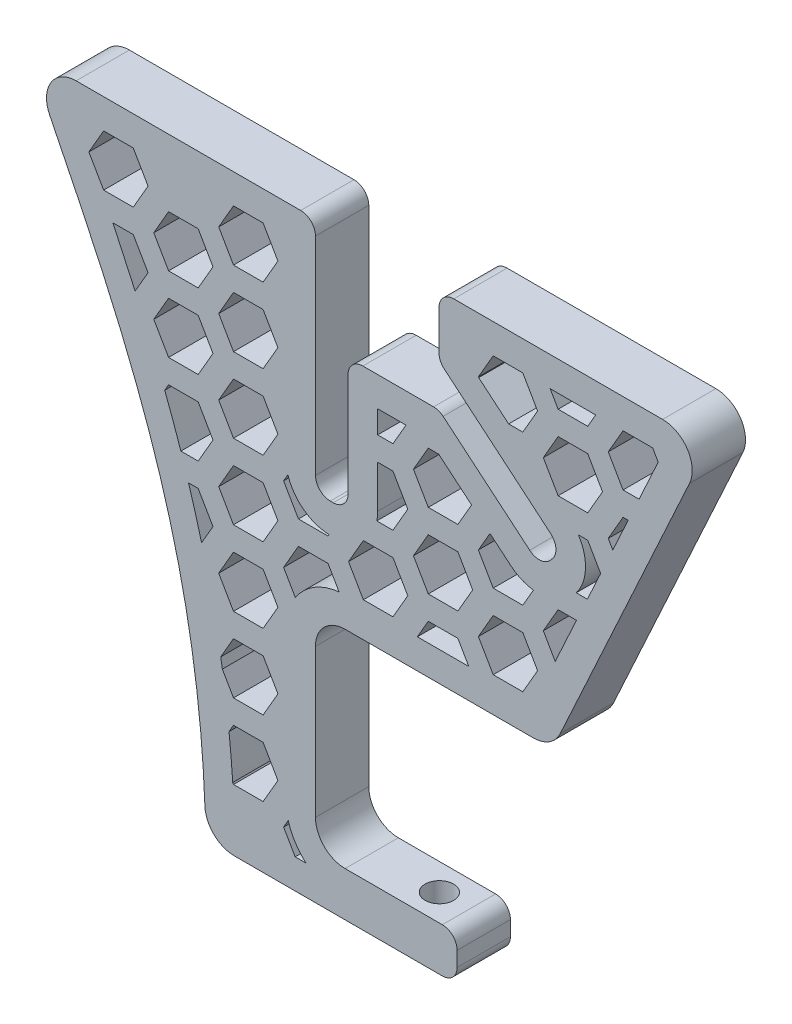
from build123d import *

# Parameters (mm, degrees)
BOSS_EXTRUDE1_DEPTH = 18
SKETCH2_R           = 4.8
CUT_EXTRUDE1_DEPTH  = 226.252230702
CUT_EXTRUDE4_DEPTH  = 173.448738534


with BuildPart() as part:
    # Sketch1 → Boss-Extrude1 (new body)
    with BuildSketch(Plane.XY):
        with BuildLine():
            Line((0, -10), (0, -60))
            ThreePointArc((0, -60), (2.928932188, -67.071067812), (10, -70))
            Line((10, -70), (42.837837838, -70))
            ThreePointArc((42.837837838, -70), (46.373371744, -71.464466094), (47.837837838, -75))
            Line((47.837837838, -75), (47.837837838, -80))
            ThreePointArc((47.837837838, -80), (46.373371744, -83.535533906), (42.837837838, -85))
            Line((42.837837838, -85), (-27.357771552, -85))
            ThreePointArc((-27.357771552, -85), (-34.290560198, -82.20669422), (-37.350269125, -75.387288317))
            add(Edge.make_bspline(
                [(-89.801053361, 100.550093593), (-65.054959436, 50.749049183), (-40.308865512, 0.948004772), (-37.350269125, -75.387288317)],
                knots=[0, 0, 0, 0, 1, 1, 1, 1], degree=3))
            ThreePointArc((-89.801053361, 100.550093593), (-89.345673636, 110.267871294), (-80.845701164, 115))
            Line((-80.845701164, 115), (-37.162162162, 115))
            Line((-37.162162162, 115), (-5, 115))
            ThreePointArc((-5, 115), (-1.464466094, 113.535533906), (0, 110))
            Line((0, 110), (0, 40))
            ThreePointArc((0, 40), (1.464466094, 36.464466094), (5, 35))
            Line((5, 35), (6, 35))
            ThreePointArc((6, 35), (9.535533906, 36.464466094), (11, 40))
            Line((11, 40), (11, 75))
            ThreePointArc((11, 75), (12.464466094, 78.535533906), (16, 80))
            Line((16, 80), (39.891524569, 80))
            ThreePointArc((39.891524569, 80), (41.601625286, 79.698463104), (43.105462618, 78.830222216))
            Line((43.105462618, 78.830222216), (72.353153466, 54.288495613))
            ThreePointArc((72.353153466, 54.288495613), (76.002870228, 53.137744338), (79.39731373, 54.90477978))
            Line((79.39731373, 54.90477978), (80.040101339, 55.670824223))
            ThreePointArc((80.040101339, 55.670824223), (81.190852614, 59.320540985), (79.423817172, 62.714984487))
            Line((79.423817172, 62.714984487), (43.497437692, 92.860796258))
            ThreePointArc((43.497437692, 92.860796258), (42.179836806, 94.577927165), (41.711375741, 96.691018473))
            Line((41.711375741, 96.691018473), (41.711375741, 110))
            ThreePointArc((41.711375741, 110), (43.175841835, 113.535533906), (46.711375741, 115))
            Line((46.711375741, 115), (117.238230772, 115))
            ThreePointArc((117.238230772, 115), (125.656960402, 110.396757492), (126.324999212, 100.824998284))
            Line((126.324999212, 100.824998284), (82.676350563, 5.824998284))
            ThreePointArc((82.676350563, 5.824998284), (78.986339615, 1.58127037), (73.589582124, 0))
            Line((73.589582124, 0), (10, 0))
            ThreePointArc((10, 0), (2.928932188, -2.928932188), (0, -10))
        make_face()
    extrude(amount=BOSS_EXTRUDE1_DEPTH)

    # Sketch2 → Cut-Extrude1 (cut, through all)
    with BuildSketch(Plane(origin=(0, -70, 0), x_dir=(1, 0, 0), z_dir=(0, 1, 0))):
        with Locations(Location((32.837837838, -9, 0), (0, 0, 270))):
            Circle(SKETCH2_R)
    extrude(amount=-CUT_EXTRUDE1_DEPTH, mode=Mode.SUBTRACT)

    # Sketch3 → Cut-Extrude4 (cut, through all)
    with BuildSketch(Plane.XY.offset(18)):
        Polygon((-12.692914369, 96.339745962), (-17.692914369, 105), (-27.692914369, 105), (-32.692914369, 96.339745962), (-27.692914369, 87.679491924), (-17.692914369, 87.679491924), align=None)
        Polygon((-56.54932083, 96.339745962), (-61.54932083, 105), (-71.54932083, 105), (-76.54932083, 96.339745962), (-71.54932083, 87.679491924), (-61.54932083, 87.679491924), align=None)
        Polygon((-49.6211176, 75.019237886), (-39.6211176, 75.019237886), (-34.6211176, 83.679491924), (-39.6211176, 92.339745962), (-49.6211176, 92.339745962), (-54.6211176, 83.679491924), align=None)
        with BuildLine():
            Line((-61.54932083, 79.679491924), (-68.430355163, 79.679491924))
            add(Edge.make_bspline(
                [(-68.430355163, 79.679491924), (-65.862714428, 74.301204118), (-63.347980443, 68.898081629), (-60.915852275, 63.456183571)],
                knots=[0.148682862, 0.148682862, 0.148682862, 0.148682862, 0.242960256, 0.242960256, 0.242960256, 0.242960256], degree=3))
            Line((-60.915852275, 63.456183571), (-56.54932083, 71.019237886))
            Line((-56.54932083, 71.019237886), (-61.54932083, 79.679491924))
        make_face()
        Polygon((-27.692914369, 62.358983849), (-17.692914369, 62.358983849), (-12.692914369, 71.019237886), (-17.692914369, 79.679491924), (-27.692914369, 79.679491924), (-32.692914369, 71.019237886), align=None)
        Polygon((-49.6211176, 49.698729811), (-39.6211176, 49.698729811), (-34.6211176, 58.358983849), (-39.6211176, 67.019237886), (-49.6211176, 67.019237886), (-54.6211176, 58.358983849), align=None)
        Polygon((-27.692914369, 37.038475773), (-17.692914369, 37.038475773), (-12.692914369, 45.698729811), (-17.692914369, 54.358983849), (-27.692914369, 54.358983849), (-32.692914369, 45.698729811), align=None)
        with BuildLine():
            Line((-49.6211176, 41.698729811), (-50.91461783, 39.458321692))
            add(Edge.make_bspline(
                [(-50.91461783, 39.458321692), (-48.998286121, 34.464891785), (-47.180316208, 29.439363379), (-45.471478569, 24.378221735)],
                knots=[0.380044477, 0.380044477, 0.380044477, 0.380044477, 0.464741705, 0.464741705, 0.464741705, 0.464741705], degree=3))
            Line((-45.471478569, 24.378221735), (-39.6211176, 24.378221735))
            Line((-39.6211176, 24.378221735), (-34.6211176, 33.038475773))
            Line((-34.6211176, 33.038475773), (-39.6211176, 41.698729811))
            Line((-39.6211176, 41.698729811), (-49.6211176, 41.698729811))
        make_face()
        Polygon((-27.692914369, 11.717967697), (-17.692914369, 11.717967697), (-12.692914369, 20.378221735), (-17.692914369, 29.038475773), (-27.692914369, 29.038475773), (-32.692914369, 20.378221735), align=None)
        with BuildLine():
            ThreePointArc((4.597392745, 25.00540406), (-4.051809524, 28.039032466), (-9.321202851, 35.538705469))
            Line((-9.321202851, 35.538705469), (-10.764711139, 33.038475773))
            Line((-10.764711139, 33.038475773), (-5.764711139, 24.378221735))
            Line((-5.764711139, 24.378221735), (4.235288861, 24.378221735))
            Line((4.235288861, 24.378221735), (4.597392745, 25.00540406))
        make_face()
        with BuildLine():
            Line((-39.6211176, 16.378221735), (-42.872236237, 16.378221735))
            add(Edge.make_bspline(
                [(-42.872236237, 16.378221735), (-41.289803734, 11.307440303), (-39.820189833, 6.199842669), (-38.468744104, 1.053683103)],
                knots=[0.509200825, 0.509200825, 0.509200825, 0.509200825, 0.593421564, 0.593421564, 0.593421564, 0.593421564], degree=3))
            Line((-38.468744104, 1.053683103), (-34.6211176, 7.717967697))
            Line((-34.6211176, 7.717967697), (-39.6211176, 16.378221735))
        make_face()
        Polygon((-27.692914369, -13.602540378), (-17.692914369, -13.602540378), (-12.692914369, -4.942286341), (-17.692914369, 3.717967697), (-27.692914369, 3.717967697), (-32.692914369, -4.942286341), align=None)
        with BuildLine():
            Line((-27.692914369, -21.602540378), (-32.005033014, -29.07134896))
            add(Edge.make_bspline(
                [(-32.005033014, -29.07134896), (-31.820036175, -30.17592328), (-31.640501475, -31.281209827), (-31.466386464, -32.387203066)],
                knots=[0.755977526, 0.755977526, 0.755977526, 0.755977526, 0.773733812, 0.773733812, 0.773733812, 0.773733812], degree=3))
            Line((-31.466386464, -32.387203066), (-27.692914369, -38.923048454))
            Line((-27.692914369, -38.923048454), (-17.692914369, -38.923048454))
            Line((-17.692914369, -38.923048454), (-12.692914369, -30.262794416))
            Line((-12.692914369, -30.262794416), (-17.692914369, -21.602540378))
            Line((-17.692914369, -21.602540378), (-27.692914369, -21.602540378))
        make_face()
        with BuildLine():
            Line((-27.692914369, -46.923048454), (-29.201186453, -49.535452335))
            add(Edge.make_bspline(
                [(-29.201186453, -49.535452335), (-29.135328315, -50.149416121), (-29.071052453, -50.763586225), (-28.587047922, -55.506124768), (-28.236795264, -59.643552419), (-27.954841306, -63.789885768)],
                knots=[0.865206228, 0.865206228, 0.865206228, 0.865206228, 0.875, 0.875, 0.94080713, 0.94080713, 0.94080713, 0.94080713], degree=3))
            Line((-27.954841306, -63.789885768), (-27.692914369, -64.24355653))
            Line((-27.692914369, -64.24355653), (-17.692914369, -64.24355653))
            Line((-17.692914369, -64.24355653), (-12.692914369, -55.583302492))
            Line((-12.692914369, -55.583302492), (-17.692914369, -46.923048454))
            Line((-17.692914369, -46.923048454), (-27.692914369, -46.923048454))
        make_face()
        with BuildLine():
            Line((-10.764711139, 7.717967697), (-6.800256508, 0.851330852))
            ThreePointArc((-6.800256508, 0.851330852), (-0.442072122, 7.05764139), (7.976980481, 9.897421743))
            Line((7.976980481, 9.897421743), (4.235288861, 16.378221735))
            Line((4.235288861, 16.378221735), (-5.764711139, 16.378221735))
            Line((-5.764711139, 16.378221735), (-10.764711139, 7.717967697))
        make_face()
        with BuildLine():
            Line((-10.764711139, -68.24355653), (-6.863876683, -75))
            Line((-6.863876683, -75), (-3.228756555, -75))
            ThreePointArc((-3.228756555, -75), (-6.894186263, -70.704507018), (-9.212869098, -65.555687269))
            Line((-9.212869098, -65.555687269), (-10.764711139, -68.24355653))
        make_face()
        with BuildLine():
            ThreePointArc((16.239384094, 29.038475773), (16.158674115, 28.963635552), (16.077417141, 28.889389587))
            Line((16.077417141, 28.889389587), (11.163492091, 20.378221735))
            Line((11.163492091, 20.378221735), (16.163492091, 11.717967697))
            Line((16.163492091, 11.717967697), (26.163492091, 11.717967697))
            Line((26.163492091, 11.717967697), (31.163492091, 20.378221735))
            Line((31.163492091, 20.378221735), (26.163492091, 29.038475773))
            Line((26.163492091, 29.038475773), (16.239384094, 29.038475773))
        make_face()
        with BuildLine():
            ThreePointArc((21, 40), (20.926002443, 38.51189682), (20.704739857, 37.038475773))
            Line((20.704739857, 37.038475773), (26.163492091, 37.038475773))
            Line((26.163492091, 37.038475773), (31.163492091, 45.698729811))
            Line((31.163492091, 45.698729811), (26.163492091, 54.358983849))
            Line((26.163492091, 54.358983849), (21, 54.358983849))
            Line((21, 54.358983849), (21, 40))
        make_face()
        Polygon((21, 70), (21, 62.358983849), (26.163492091, 62.358983849), (30.575034823, 70), align=None)
        Polygon((52.717435344, 57.710746553), (41.624007356, 67.019237886), (38.091695321, 67.019237886), (33.091695321, 58.358983849), (38.091695321, 49.698729811), (48.091695321, 49.698729811), align=None)
        Polygon((38.091695321, 24.378221735), (48.091695321, 24.378221735), (53.091695321, 33.038475773), (48.091695321, 41.698729811), (38.091695321, 41.698729811), (33.091695321, 33.038475773), align=None)
        Polygon((60.019898552, 11.717967697), (70.019898552, 11.717967697), (75.019898552, 20.378221735), (70.019898552, 29.038475773), (60.019898552, 29.038475773), (55.019898552, 20.378221735), align=None)
        Polygon((38.091695321, 16.378221735), (34.409227286, 10), (51.774163357, 10), (48.091695321, 16.378221735), align=None)
        with BuildLine():
            Line((65.925277369, 46.628051181), (58.940330652, 52.489117395))
            Line((58.940330652, 52.489117395), (55.019898552, 45.698729811))
            Line((55.019898552, 45.698729811), (60.019898552, 37.038475773))
            Line((60.019898552, 37.038475773), (70.019898552, 37.038475773))
            Line((70.019898552, 37.038475773), (73.604755708, 43.247630505))
            ThreePointArc((73.604755708, 43.247630505), (69.523840318, 44.389948219), (65.925277369, 46.628051181))
        make_face()
        Polygon((80.972323457, 26.068319372), (88.153863388, 41.698729811), (81.948101782, 41.698729811), (76.948101782, 33.038475773), align=None)
        with BuildLine():
            ThreePointArc((88.812668754, 67.019237886), (91.196037806, 58.240520125), (88.068074924, 49.698729811))
            Line((88.068074924, 49.698729811), (91.829539064, 49.698729811))
            Line((91.829539064, 49.698729811), (96.313553081, 59.458054438))
            Line((96.313553081, 59.458054438), (91.948101782, 67.019237886))
            Line((91.948101782, 67.019237886), (88.812668754, 67.019237886))
        make_face()
        Polygon((98.876305012, 71.019237886), (100.407172734, 68.367697212), (105.604483818, 79.679491924), (103.876305012, 79.679491924), align=None)
        Polygon((81.948101782, 75.019237886), (91.948101782, 75.019237886), (96.948101782, 83.679491924), (91.948101782, 92.339745962), (81.948101782, 92.339745962), (76.948101782, 83.679491924), align=None)
        Polygon((55.124461344, 96.158637893), (65.229514015, 87.679491924), (70.019898552, 87.679491924), (75.019898552, 96.339745962), (70.019898552, 105), (60.019898552, 105), (55.019898552, 96.339745962), align=None)
        Polygon((94.638700705, 105), (79.257502859, 105), (81.948101782, 100.339745962), (91.948101782, 100.339745962), align=None)
        Polygon((103.876305012, 87.679491924), (109.280159494, 87.679491924), (115.748402359, 101.757432278), (113.876305012, 105), (103.876305012, 105), (98.876305012, 96.339745962), align=None)
    extrude(amount=-CUT_EXTRUDE4_DEPTH, mode=Mode.SUBTRACT)


solid = part.part
